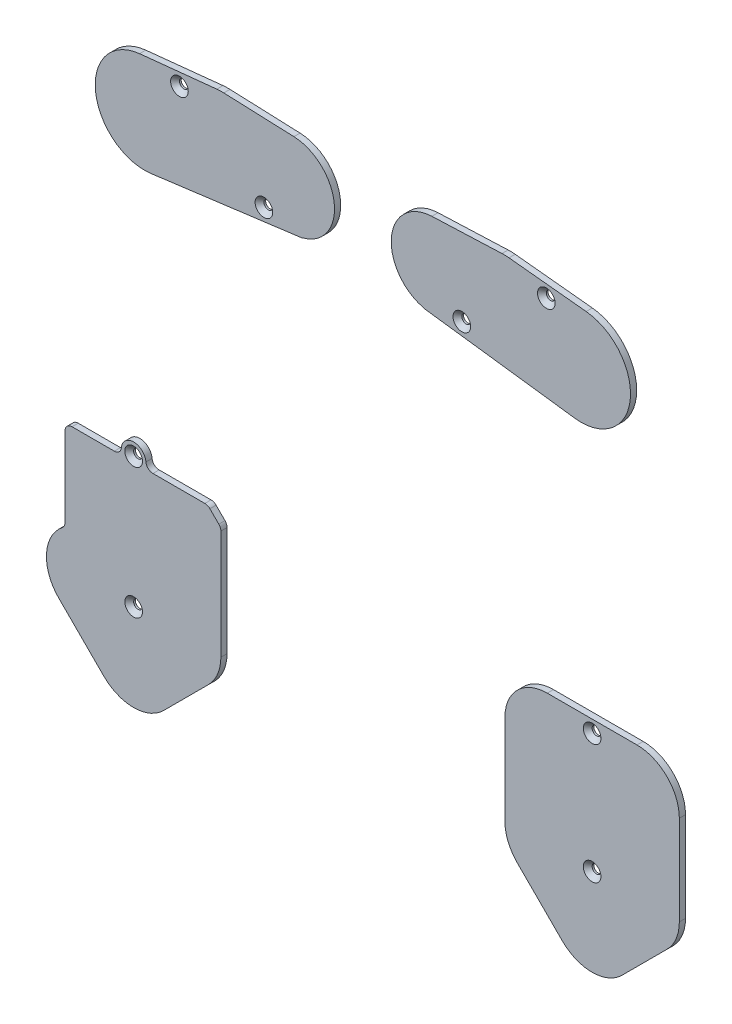
from build123d import *

# Parameters (mm, degrees)
SKETCH1_R                                      = 1.25
BOSS_EXTRUDE1_DEPTH                            = 1.75
BOSS_EXTRUDE1_2_DEPTH                          = 1.75
BOSS_EXTRUDE1_3_DEPTH                          = 1.75
BOSS_EXTRUDE1_4_DEPTH                          = 1.75
CSK_FOR_M2_5_FLAT_HEAD_MACHINE_SCREW1_AT_COUNT = 2
CSK_FOR_M2_5_FLAT_HEAD_MACHINE_SCREW1_AT_PITCH = 37
CSK_FOR_M2_5_FLAT_HEAD_MACHINE_SCREW_2_COUNT   = 2
CSK_FOR_M2_5_FLAT_HEAD_MACHINE_SCREW_2_PITCH   = 98.187021999
CSK_FOR_M2_5_FLAT_HEAD_MACHINE_SCREW_3_COUNT   = 2
CSK_FOR_M2_5_FLAT_HEAD_MACHINE_SCREW_3_PITCH   = 87.737908903
CSK_FOR_M2_5_FLAT_HEAD_MACHINE_SCREW_4_COUNT   = 2
CSK_FOR_M2_5_FLAT_HEAD_MACHINE_SCREW_4_PITCH   = 152.197291874
CSK_FOR_M2_5_FLAT_HEAD_MACHINE_SCREW_5_COUNT   = 2
CSK_FOR_M2_5_FLAT_HEAD_MACHINE_SCREW_5_PITCH   = 122.44732595
CSK_FOR_M2_5_FLAT_HEAD_MACHINE_SCREW_6_COUNT   = 2
CSK_FOR_M2_5_FLAT_HEAD_MACHINE_SCREW_6_PITCH   = 130.035636981
CSK_FOR_M2_5_FLAT_HEAD_MACHINE_SCREW_7_COUNT   = 2
CSK_FOR_M2_5_FLAT_HEAD_MACHINE_SCREW_7_PITCH   = 135.162864723
FILLET1_R                                      = 2


with BuildPart() as part:
    # Sketch1 → Boss-Extrude1 (new body)
    with BuildSketch(Plane.XY):
        with BuildLine():
            Line((-43.968986643, -24.5), (-40.272077939, -28.196908704))
            Line((-40.272077939, -28.196908704), (-40.272077939, -60))
            ThreePointArc((-40.272077939, -60), (-41.185523549, -64.592201188), (-43.786796564, -68.485281374))
            Line((-43.786796564, -68.485281374), (-56.514718626, -81.213203436))
            ThreePointArc((-56.514718626, -81.213203436), (-65, -84.727922061), (-73.485281374, -81.213203436))
            Line((-73.485281374, -81.213203436), (-86.213203436, -68.485281374))
            ThreePointArc((-86.213203436, -68.485281374), (-89.709417347, -59.333838811), (-85.220263131, -50.626376085))
            ThreePointArc((-85.220263131, -50.626376085), (-84.666565074, -49.930867504), (-84.468986643, -49.064105433))
            Line((-84.468986643, -49.064105433), (-84.468986643, -26.5))
            ThreePointArc((-84.468986643, -26.5), (-83.883200205, -25.085786438), (-82.468986643, -24.5))
            Line((-82.468986643, -24.5), (-70.477225575, -24.5))
            ThreePointArc((-70.477225575, -24.5), (-69.12882585, -23.977097892), (-68.485507184, -22.681818182))
            ThreePointArc((-68.485507184, -22.681818182), (-65, -19.5), (-61.514492816, -22.681818182))
            ThreePointArc((-61.514492816, -22.681818182), (-60.87117415, -23.977097892), (-59.522774425, -24.5))
            Line((-59.522774425, -24.5), (-43.968986643, -24.5))
        make_face()
        with Locations((-65, -60)):
            Circle(SKETCH1_R, mode=Mode.SUBTRACT)
        with Locations((-65, -23)):
            Circle(SKETCH1_R, mode=Mode.SUBTRACT)
    extrude(amount=BOSS_EXTRUDE1_DEPTH)

    # Sketch3 → CSK for M2.5 Flat Head Machine Screw1 (revolve, cut)
    with BuildSketch(Plane(origin=(-65, -23, 1.75), x_dir=(0, -1, 0), z_dir=(1, 0, 0))):
        Polygon((0, 0), (0, 1.75), (1.25, 1.75), (1.25, 1.25), (2.5, 0), align=None)
    csk_for_m2_5_flat_head_machine_screw1 = revolve(axis=Axis((-65, -23, 8.1), (0, 0, -1)), mode=Mode.SUBTRACT)

    # CSK for M2.5 Flat Head Machine Screw1 at: CSK for M2.5 Flat Head Machine Screw1 ×2
    with Locations(*[(0, -i * CSK_FOR_M2_5_FLAT_HEAD_MACHINE_SCREW1_AT_PITCH, 0) for i in range(1, CSK_FOR_M2_5_FLAT_HEAD_MACHINE_SCREW1_AT_COUNT)]):
        add(csk_for_m2_5_flat_head_machine_screw1, mode=Mode.SUBTRACT)

    # Fillet1
    fillet1_edges = [part.edges().sort_by_distance(p)[0] for p in [
        (-43.968986643, -24.5, 0.875),
        (-40.272077939, -28.196908704, 0.875),
    ]]
    fillet(fillet1_edges, radius=FILLET1_R)


with BuildPart() as body_2:
    # Sketch1 → Boss-Extrude1 2 (new body)
    with BuildSketch(Plane.XY):
        with BuildLine():
            Line((89.727922061, -60), (89.727922061, -34.544155877))
            ThreePointArc((89.727922061, -34.544155877), (86.213203436, -26.058874503), (77.727922061, -22.544155877))
            Line((77.727922061, -22.544155877), (52.272077939, -22.544155877))
            ThreePointArc((52.272077939, -22.544155877), (43.786796564, -26.058874503), (40.272077939, -34.544155877))
            Line((40.272077939, -34.544155877), (40.272077939, -60))
            ThreePointArc((40.272077939, -60), (41.185523549, -64.592201188), (43.786796564, -68.485281374))
            Line((43.786796564, -68.485281374), (56.514718626, -81.213203436))
            ThreePointArc((56.514718626, -81.213203436), (65, -84.727922061), (73.485281374, -81.213203436))
            Line((73.485281374, -81.213203436), (86.213203436, -68.485281374))
            ThreePointArc((86.213203436, -68.485281374), (88.814476451, -64.592201188), (89.727922061, -60))
        make_face()
        with Locations((65, -60)):
            Circle(SKETCH1_R, mode=Mode.SUBTRACT)
        with Locations((65, -26.044155877)):
            Circle(SKETCH1_R, mode=Mode.SUBTRACT)
    extrude(amount=BOSS_EXTRUDE1_2_DEPTH)

    # CSK for M2.5 Flat Head Machine Screw 6: CSK for M2.5 Flat Head Machine Screw1 ×2
    with Locations(*[Vector(0.9997259445053818, -0.023410166227997686, 0) * (i * CSK_FOR_M2_5_FLAT_HEAD_MACHINE_SCREW_6_PITCH) for i in range(1, CSK_FOR_M2_5_FLAT_HEAD_MACHINE_SCREW_6_COUNT)]):
        add(csk_for_m2_5_flat_head_machine_screw1, mode=Mode.SUBTRACT)

    # CSK for M2.5 Flat Head Machine Screw 7: CSK for M2.5 Flat Head Machine Screw1 ×2
    with Locations(*[Vector(0.9618026391115247, -0.2737438280548188, 0) * (i * CSK_FOR_M2_5_FLAT_HEAD_MACHINE_SCREW_7_PITCH) for i in range(1, CSK_FOR_M2_5_FLAT_HEAD_MACHINE_SCREW_7_COUNT)]):
        add(csk_for_m2_5_flat_head_machine_screw1, mode=Mode.SUBTRACT)


with BuildPart() as body_3:
    # Sketch1 → Boss-Extrude1 3 (new body)
    with BuildSketch(Plane.XY):
        with BuildLine():
            Line((63.312201165, 76.685087798), (41.426741745, 78.92711054))
            ThreePointArc((41.426741745, 78.92711054), (40.43395974, 78.993272632), (39.438985809, 78.988754879))
            Line((39.438985809, 78.988754879), (19.555221001, 78.191323348))
            ThreePointArc((19.555221001, 78.191323348), (8.106309017, 67.497232972), (16.991142128, 54.593710385))
            ThreePointArc((16.991142128, 54.593710385), (17.191171735, 54.529840537), (17.383402479, 54.445350645))
            Line((17.383402479, 54.445350645), (60.074279954, 48.875627711))
            ThreePointArc((60.074279954, 48.875627711), (75.791518016, 61.138861966), (63.312201165, 76.685087798))
        make_face()
        with Locations((52.012786019, 74.324321534)):
            Circle(SKETCH1_R, mode=Mode.SUBTRACT)
        with Locations((28.059257591, 56.582172683)):
            Circle(SKETCH1_R, mode=Mode.SUBTRACT)
    extrude(amount=BOSS_EXTRUDE1_3_DEPTH)

    # CSK for M2.5 Flat Head Machine Screw 4: CSK for M2.5 Flat Head Machine Screw1 ×2
    with Locations(*[Vector(0.7688230491999356, 0.6394615852566231, 0) * (i * CSK_FOR_M2_5_FLAT_HEAD_MACHINE_SCREW_4_PITCH) for i in range(1, CSK_FOR_M2_5_FLAT_HEAD_MACHINE_SCREW_4_COUNT)]):
        add(csk_for_m2_5_flat_head_machine_screw1, mode=Mode.SUBTRACT)

    # CSK for M2.5 Flat Head Machine Screw 5: CSK for M2.5 Flat Head Machine Screw1 ×2
    with Locations(*[Vector(0.7599942005192046, 0.6499298540436306, 0) * (i * CSK_FOR_M2_5_FLAT_HEAD_MACHINE_SCREW_5_PITCH) for i in range(1, CSK_FOR_M2_5_FLAT_HEAD_MACHINE_SCREW_5_COUNT)]):
        add(csk_for_m2_5_flat_head_machine_screw1, mode=Mode.SUBTRACT)


with BuildPart() as body_4:
    # Sketch1 → Boss-Extrude1 4 (new body)
    with BuildSketch(Plane.XY):
        with BuildLine():
            Line((-41.426741745, 78.92711054), (-63.312201165, 76.685087798))
            ThreePointArc((-63.312201165, 76.685087798), (-75.791518016, 61.138861966), (-60.074279954, 48.875627711))
            Line((-60.074279954, 48.875627711), (-17.383402479, 54.445350645))
            ThreePointArc((-17.383402479, 54.445350645), (-17.191171735, 54.529840537), (-16.991142128, 54.593710385))
            ThreePointArc((-16.991142128, 54.593710385), (-8.106309017, 67.497232972), (-19.555221001, 78.191323348))
            Line((-19.555221001, 78.191323348), (-39.438985809, 78.988754879))
            ThreePointArc((-39.438985809, 78.988754879), (-40.43395974, 78.993272632), (-41.426741745, 78.92711054))
        make_face()
        with Locations((-28.059257591, 56.582172683)):
            Circle(SKETCH1_R, mode=Mode.SUBTRACT)
        with Locations((-52.012786019, 74.324321534)):
            Circle(SKETCH1_R, mode=Mode.SUBTRACT)
    extrude(amount=BOSS_EXTRUDE1_4_DEPTH)

    # CSK for M2.5 Flat Head Machine Screw 2: CSK for M2.5 Flat Head Machine Screw1 ×2
    with Locations(*[Vector(0.1322701688752495, 0.9912137016938946, 0) * (i * CSK_FOR_M2_5_FLAT_HEAD_MACHINE_SCREW_2_PITCH) for i in range(1, CSK_FOR_M2_5_FLAT_HEAD_MACHINE_SCREW_2_COUNT)]):
        add(csk_for_m2_5_flat_head_machine_screw1, mode=Mode.SUBTRACT)

    # CSK for M2.5 Flat Head Machine Screw 3: CSK for M2.5 Flat Head Machine Screw1 ×2
    with Locations(*[Vector(0.42103513602016673, 0.9070443287053174, 0) * (i * CSK_FOR_M2_5_FLAT_HEAD_MACHINE_SCREW_3_PITCH) for i in range(1, CSK_FOR_M2_5_FLAT_HEAD_MACHINE_SCREW_3_COUNT)]):
        add(csk_for_m2_5_flat_head_machine_screw1, mode=Mode.SUBTRACT)


solid = Compound([part.part, body_2.part, body_3.part, body_4.part])
